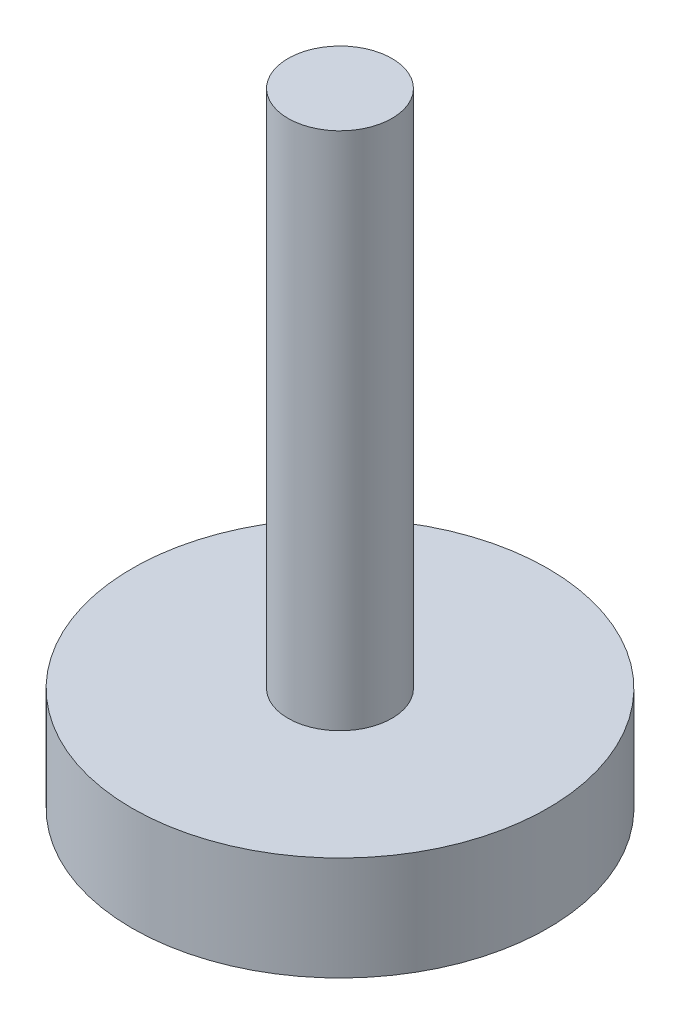
from build123d import *

# Parameters (mm, degrees)
SKETCH_1_R      = 4
EXTRUDE_1_DEPTH = 2
SKETCH_2_R      = 1
EXTRUDE_2_DEPTH = 10


with BuildPart() as part:
    # 草图1 → 凸台-拉伸1 (new body)
    with BuildSketch(Plane(origin=(0, 0, 0), x_dir=(1, 0, 0), z_dir=(0, 1, 0))):
        with Locations(Location((0, 0, 0), (0, 0, 270))):
            Circle(SKETCH_1_R)
    extrude(amount=EXTRUDE_1_DEPTH)

    # 草图2 → 凸台-拉伸2 (add)
    with BuildSketch(Plane(origin=(0, 2, 0), x_dir=(1, 0, 0), z_dir=(0, 1, 0))):
        with Locations(Location((0, 0, 0), (0, 0, 270))):
            Circle(SKETCH_2_R)
    extrude(amount=EXTRUDE_2_DEPTH)


solid = part.part
